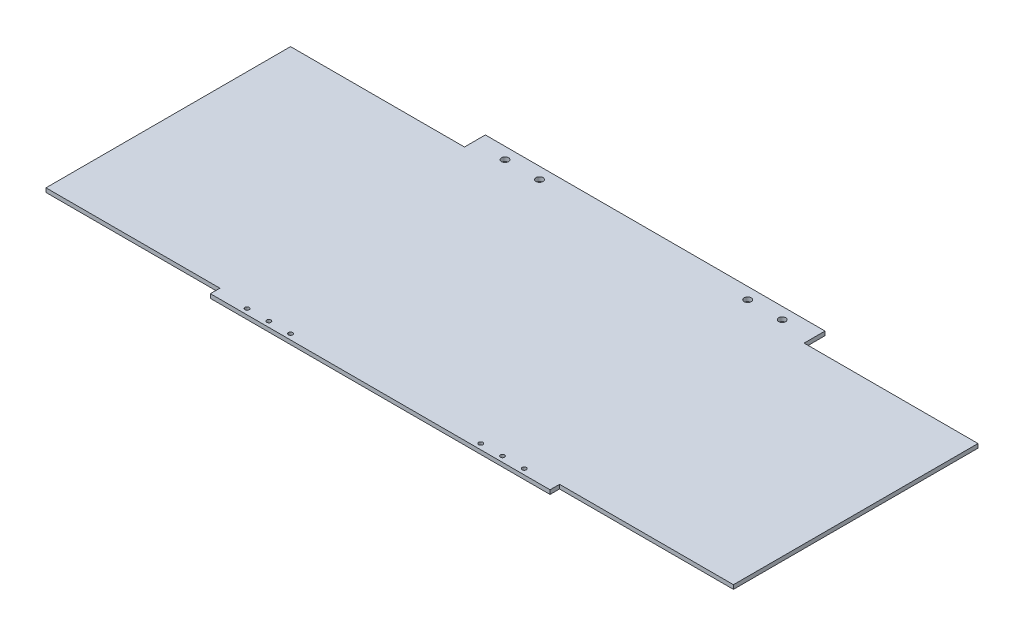
from build123d import *

# Parameters (mm, degrees)
SKETCH1_R           = 2.564
SKETCH1_R_2         = 1.54
BOSS_EXTRUDE1_DEPTH = 3


with BuildPart() as part:
    # Sketch1 → Boss-Extrude1 (new body)
    with BuildSketch(Plane(origin=(0, 0, 0), x_dir=(1, 0, 0), z_dir=(0, 1, 0))):
        Polygon((128, 0), (128, -7), (378, -7), (378, 0), (506, 0), (506, 180), (378, 180), (378, 195.398), (128, 195.398), (128, 180), (0, 180), (0, 0), align=None)
        with Locations(Location((151, 186.858, 0), (0, 0, 270))):
            Circle(SKETCH1_R, mode=Mode.SUBTRACT)
        with Locations(Location((176.4, 186.858, 0), (0, 0, 270))):
            Circle(SKETCH1_R, mode=Mode.SUBTRACT)
        with Locations(Location((151, -3, 0), (0, 0, 270))):
            Circle(SKETCH1_R_2, mode=Mode.SUBTRACT)
        with Locations(Location((183, -3, 0), (0, 0, 270))):
            Circle(SKETCH1_R_2, mode=Mode.SUBTRACT)
        with Locations(Location((329.6, 186.858, 0), (0, 0, 90))):
            Circle(SKETCH1_R, mode=Mode.SUBTRACT)
        with Locations(Location((355, 186.858, 0), (0, 0, 90))):
            Circle(SKETCH1_R, mode=Mode.SUBTRACT)
        with Locations(Location((167, -3, 0), (0, 0, 270))):
            Circle(SKETCH1_R_2, mode=Mode.SUBTRACT)
        with Locations(Location((323, -3, 0), (0, 0, 90))):
            Circle(SKETCH1_R_2, mode=Mode.SUBTRACT)
        with Locations(Location((339, -3, 0), (0, 0, 90))):
            Circle(SKETCH1_R_2, mode=Mode.SUBTRACT)
        with Locations(Location((355, -3, 0), (0, 0, 90))):
            Circle(SKETCH1_R_2, mode=Mode.SUBTRACT)
    extrude(amount=BOSS_EXTRUDE1_DEPTH)


solid = part.part
